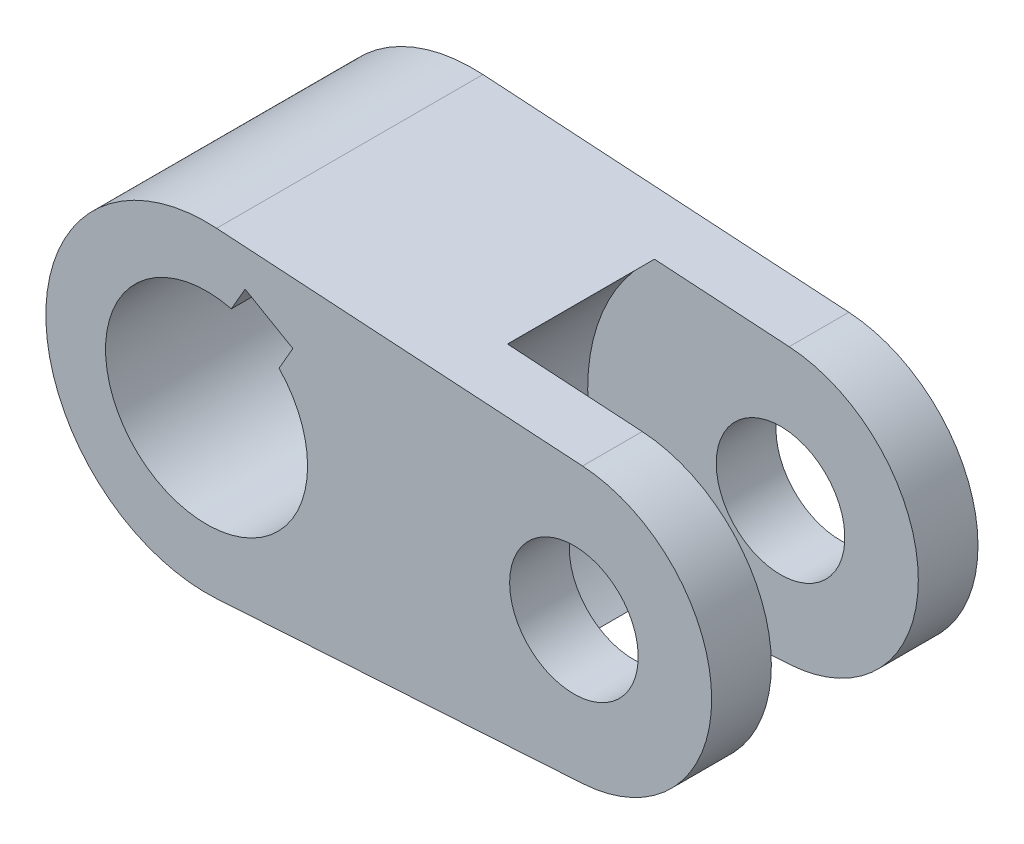
from build123d import *

# Parameters (mm, degrees)
SKETCH_1_R          = 7
EXTRUDE_1_DEPTH     = 14.5
SKETCH_3_R          = 21
CUT_EXTRUDE_1_DEPTH = 8


with BuildPart() as part:
    # Эскиз1 → Бобышка-Вытянуть1 (new, symmetric)
    with BuildSketch(Plane.XY):
        with BuildLine():
            Line((40.9375, 14.970674459), (1.09375, 17.465786869))
            ThreePointArc((1.09375, 17.465786869), (-17.5, 0), (1.09375, -17.465786869))
            Line((1.09375, -17.465786869), (40.9375, -14.970674459))
            ThreePointArc((40.9375, -14.970674459), (55, 0), (40.9375, 14.970674459))
        make_face()
        with Locations(Location((40, 0, 0), (0, 0, 180))):
            Circle(SKETCH_1_R, mode=Mode.SUBTRACT)
        with BuildLine():
            Line((2.693426411, 10.66515139), (4.201923789, 13.277945491))
            Line((4.201923789, 13.277945491), (9.398076211, 10.277945491))
            Line((9.398076211, 10.277945491), (7.889578833, 7.66515139))
            ThreePointArc((7.889578833, 7.66515139), (-5.5, -9.526279442), (2.693426411, 10.66515139))
        make_face(mode=Mode.SUBTRACT)
    extrude(amount=EXTRUDE_1_DEPTH, both=True)

    # Эскиз3 → Вырез-Вытянуть1 (cut, symmetric)
    with BuildSketch(Plane.XY):
        with Locations((40, 0)):
            Circle(SKETCH_3_R)
    extrude(amount=CUT_EXTRUDE_1_DEPTH, both=True, mode=Mode.SUBTRACT)


solid = part.part
